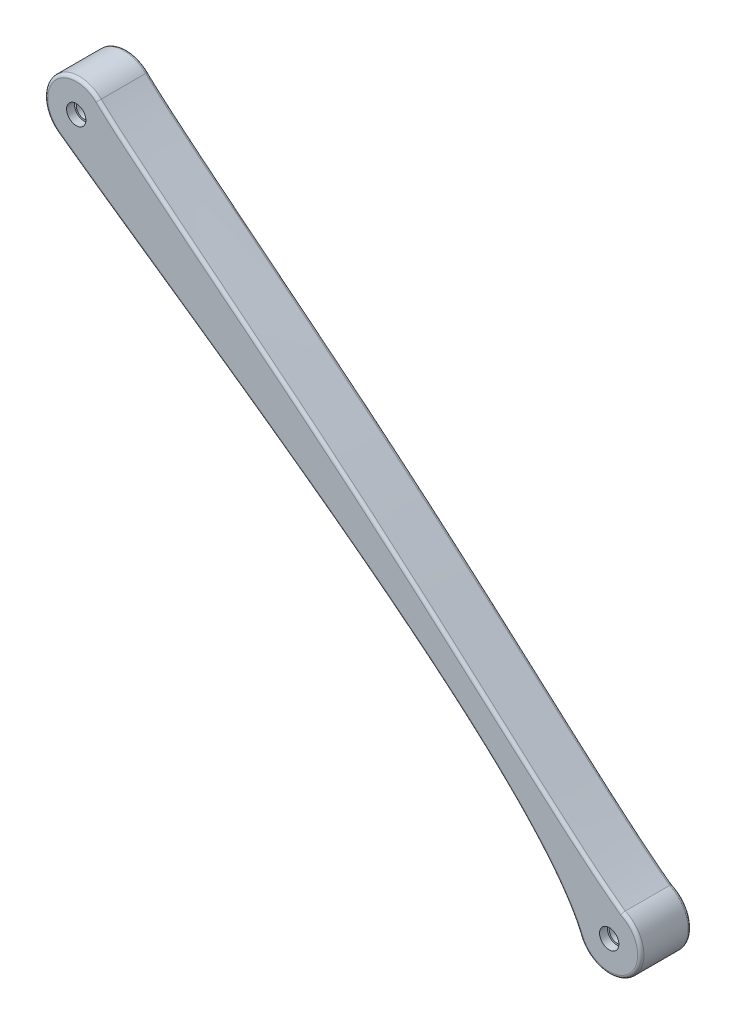
from build123d import *

# Parameters (mm, degrees)
SKETCH1_R           = 10
BOSS_EXTRUDE1_DEPTH = 8
SKETCH2_R           = 3.05
CUT_EXTRUDE1_DEPTH  = 2.5
SKETCH3_R           = 2.5
CUT_EXTRUDE2_DEPTH  = 235.228224388
FILLET1_R           = 1


with BuildPart() as part:
    # Sketch1 → Boss-Extrude1 (new body)
    with BuildSketch(Plane.XY):
        Circle(SKETCH1_R)
        with BuildLine():
            ThreePointArc((6.932380368, 7.207086959), (9.20119024, 3.916388408), (10, 0))
            ThreePointArc((10, 0), (4.519348384, -8.920509525), (-5.915098037, -8.062978061))
            add(Edge.make_bspline(
                [(-5.915098037, -8.062978061), (34.718192947, -37.87205083), (143.515545331, -107.14371417), (159.290587236, -145.239154883)],
                knots=[0, 0, 0, 0, 1, 1, 1, 1], degree=3))
            ThreePointArc((159.290587236, -145.239154883), (161.565900633, -134.236616192), (172.63191834, -132.293381565))
            add(Edge.make_bspline(
                [(6.932380368, 7.207086959), (17.244305655, -2.711787175), (60.227105828, -35.931261983), (124.750363865, -90.380113257), (157.248120819, -121.224147407), (172.63191834, -132.293381565)],
                knots=[0, 0, 0, 0, 0.399023762, 0.499023762, 1, 1, 1, 1], degree=3))
        make_face()
        with Locations((168.529777486, -141.413274131)):
            Circle(SKETCH1_R)
    boss_extrude1 = extrude(amount=BOSS_EXTRUDE1_DEPTH)

    # Sketch2 → Cut-Extrude1 (cut)
    with BuildSketch(Plane.XY.offset(8)):
        Circle(SKETCH2_R)
        with Locations((168.529777486, -141.413274131)):
            Circle(SKETCH2_R)
    cut_extrude1 = extrude(amount=-CUT_EXTRUDE1_DEPTH, mode=Mode.SUBTRACT)

    # Sketch3 → Cut-Extrude2 (cut, through all)
    with BuildSketch(Plane.XY.offset(8)):
        Circle(SKETCH3_R)
        with Locations((168.529777486, -141.413274131)):
            Circle(SKETCH3_R)
    cut_extrude2 = extrude(amount=-CUT_EXTRUDE2_DEPTH, mode=Mode.SUBTRACT)

    # Mirror1: Boss-Extrude1, Cut-Extrude1, Cut-Extrude2 across plane
    add(boss_extrude1.mirror(Plane.XY))
    add(cut_extrude1.mirror(Plane.XY), mode=Mode.SUBTRACT)
    add(cut_extrude2.mirror(Plane.XY), mode=Mode.SUBTRACT)

    # Fillet1
    fillet1_edges = [part.edges().sort_by_distance(p)[0] for p in [
        (82.198981844, -70.686100864, 8),
        (175.493654339, -148.58993207, 8),
        (90.595273902, -61.585291098, 8),
        (-7.651956434, 6.437978156, -8),
        (175.493654339, -148.58993207, -8),
        (82.198981844, -70.686100864, -8),
        (90.595273902, -61.585291098, -8),
        (-7.651956434, 6.437978156, 8),
    ]]
    fillet(fillet1_edges, radius=FILLET1_R)


solid = part.part
